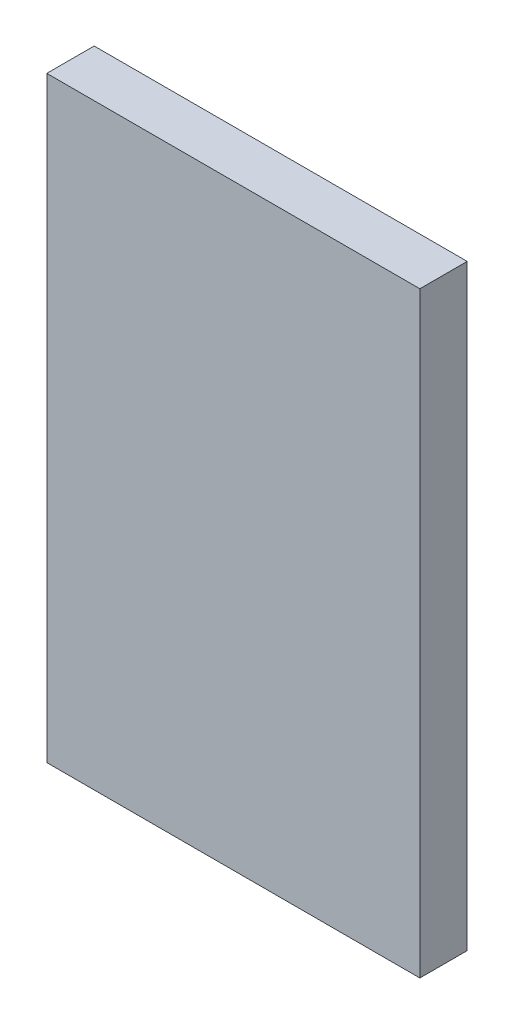
from build123d import *

# Parameters (mm, degrees)
SKETCH1_W           = 50
SKETCH1_H           = 80
BOSS_EXTRUDE1_DEPTH = 6.35


with BuildPart() as part:
    # Sketch1 → Boss-Extrude1 (new body)
    with BuildSketch(Plane.XY):
        Rectangle(SKETCH1_W, SKETCH1_H)
    extrude(amount=BOSS_EXTRUDE1_DEPTH)


solid = part.part
